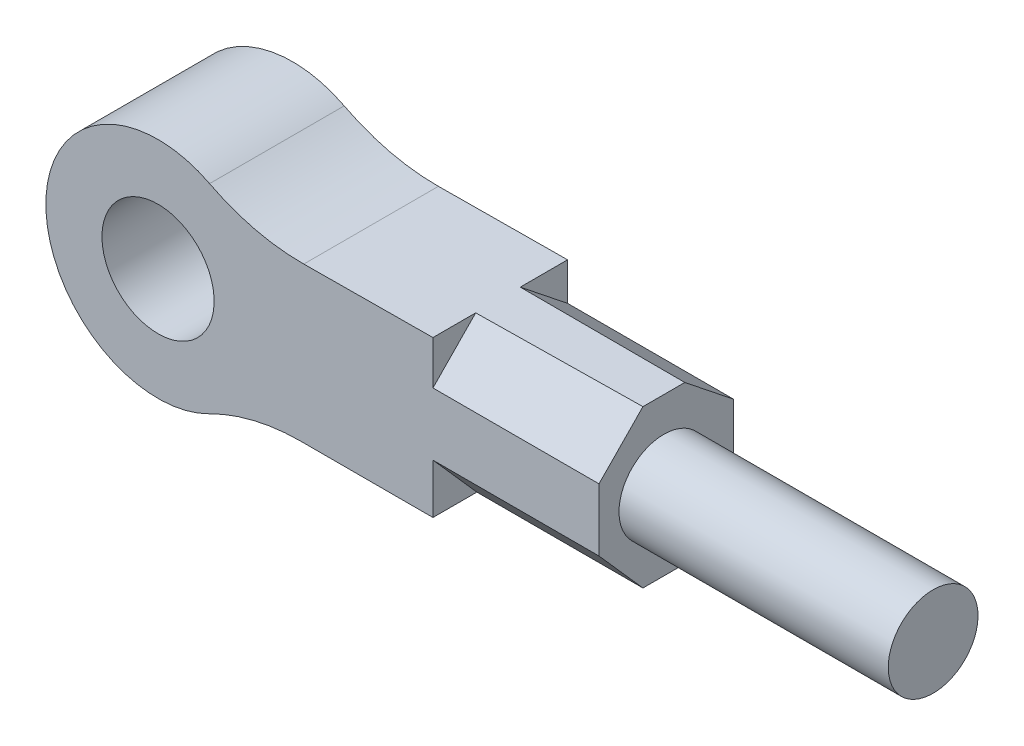
from build123d import *

# Parameters (mm, degrees)
SKETCH1_R           = 25
BOSS_EXTRUDE1_DEPTH = 60
CUT_EXTRUDE1_DEPTH  = 74
SKETCH3_R           = 20
BOSS_EXTRUDE2_DEPTH = 120


with BuildPart() as part:
    # Sketch1 → Boss-Extrude1 (new body)
    with BuildSketch(Plane.XY):
        with BuildLine():
            Line((64.94754869, 34.367143049), (196.507423933, 35.326035965))
            Line((196.507423933, 35.326035965), (196.511673709, -34.673963906))
            Line((196.511673709, -34.673963906), (63.689894991, -34.673963906))
            ThreePointArc((63.689894991, -34.673963906), (42.633771657, -37.171737248), (22.746391068, -44.526415681))
            ThreePointArc((22.746391068, -44.526415681), (-49.999854067, 0.120802809), (22.961281527, 44.415983054))
            ThreePointArc((22.961281527, 44.415983054), (43.342950879, 36.836730802), (64.94754869, 34.367143049))
        make_face()
        with Locations(Location((0, 0, 0), (0, 0, 180))):
            Circle(SKETCH1_R, mode=Mode.SUBTRACT)
    extrude(amount=BOSS_EXTRUDE1_DEPTH)

    # Sketch2 → Cut-Extrude1 (cut)
    with BuildSketch(Plane(origin=(196.509567891, 0.011930308, 0), x_dir=(0, 0, -1), z_dir=(0.9999999981570824, 6.0711079910172726e-05, 0))):
        Polygon((-60, 15.314105722), (-40.419671978, 35.314105722), (-60, 35.314105722), align=None)
        Polygon((0, 35.314105722), (-21.759605821, 35.314105722), (0, 17.974594403), align=None)
        Polygon((-40.419671978, -34.685894278), (-60, -12.535294787), (-60, -34.685894278), align=None)
        Polygon((0, -34.685894278), (0, -16.195205155), (-18.490689122, -34.685894278), align=None)
    extrude(amount=-CUT_EXTRUDE1_DEPTH, mode=Mode.SUBTRACT)

    # Sketch3 → Boss-Extrude2 (add)
    with BuildSketch(Plane(origin=(196.509567891, 0.011930308, 0), x_dir=(0, 0, -1), z_dir=(0.9999999981570824, 6.0711079910172726e-05, 0))):
        with Locations(Location((-31.0896389, 0, 0), (0, 0, 90))):
            Circle(SKETCH3_R)
    extrude(amount=BOSS_EXTRUDE2_DEPTH)


solid = part.part
